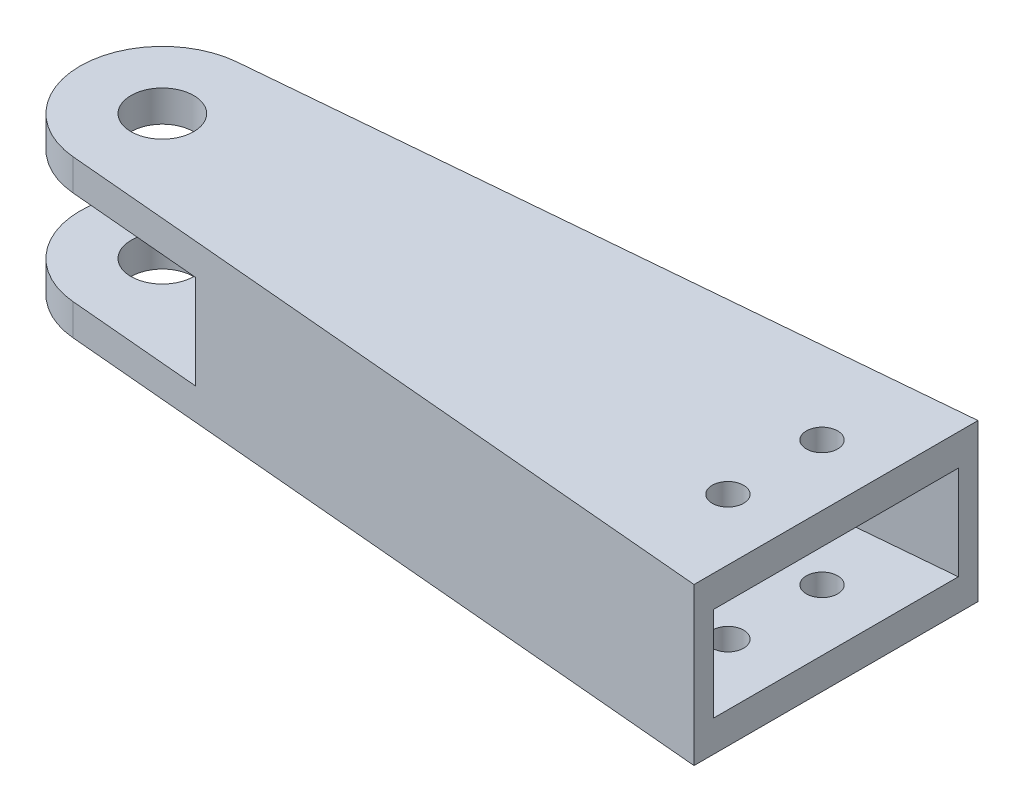
from build123d import *

# Parameters (mm, degrees)
BOSS_EXTRUDE1_DEPTH          = 4
BOSS_EXTRUDE2_DEPTH          = 12
BOSS_EXTRUDE3_DEPTH          = 4
SKETCH4_W                    = 31.19276455
SKETCH4_H                    = 12
CUT_EXTRUDE1_DEPTH           = 20
DRAFT1_ANGLE                 = 5.033187306
F_4_0_4_DIAMETER_HOLE1_D     = 4
F_4_0_4_DIAMETER_HOLE1_DEPTH = 4
F_4_0_4_DIAMETER_HOLE2_D     = 4
F_4_0_4_DIAMETER_HOLE2_DEPTH = 20
F_8_0_8_DIAMETER_HOLE1_D     = 8
F_8_0_8_DIAMETER_HOLE1_DEPTH = 4
F_8_0_8_DIAMETER_HOLE2_D     = 8


with BuildPart() as part:
    # Sketch1 → Boss-Extrude1 (new body)
    with BuildSketch(Plane(origin=(0, 20, 0), x_dir=(1, 0, 0), z_dir=(0, 1, 0))):
        with BuildLine():
            Line((-75, -18.10605947), (-75, 18.10605947))
            Line((-75, 18.10605947), (-161.821193893, 10.459512504))
            ThreePointArc((-161.821193893, 10.459512504), (-171.4, 0), (-161.821193893, -10.459512504))
            Line((-161.821193893, -10.459512504), (-75, -18.10605947))
        make_face()
    extrude(amount=-BOSS_EXTRUDE1_DEPTH)

    # Sketch2 → Boss-Extrude2 (add)
    with BuildSketch(Plane.XZ.offset(-16)):
        Polygon((-75, -18.10605947), (-144.730083357, -11.964766849), (-144.510751478, -9.47440673), (-144.510751478, 9.47440673), (-144.730083357, 11.964766849), (-75, 18.10605947), align=None)
    extrude(amount=BOSS_EXTRUDE2_DEPTH)

    # Sketch3 → Boss-Extrude3 (add)
    with BuildSketch(Plane.XZ.offset(-4)):
        with BuildLine():
            Line((-75, -18.10605947), (-161.821193893, -10.459512504))
            ThreePointArc((-161.821193893, -10.459512504), (-171.4, 0), (-161.821193893, 10.459512504))
            Line((-161.821193893, 10.459512504), (-75, 18.10605947))
            Line((-75, 18.10605947), (-75, -18.10605947))
        make_face()
    extrude(amount=BOSS_EXTRUDE3_DEPTH)

    # Sketch4 → Cut-Extrude1 (cut)
    with BuildSketch(Plane(origin=(-75, 0, 0), x_dir=(0, 0, -1), z_dir=(1, 0, 0))):
        with Locations((0, 10)):
            Rectangle(SKETCH4_W, SKETCH4_H)
    extrude(amount=-CUT_EXTRUDE1_DEPTH, mode=Mode.SUBTRACT)

    # Draft1
    draft1_faces = [part.faces().sort_by_distance(p)[0] for p in [
        (-85, 10, 15.596382275),
        (-85, 10, -15.596382275),
    ]]
    draft(draft1_faces, Plane(origin=(-75, 16, 18.10605947), x_dir=(0, 0, 1), z_dir=(1, 0, 0)), DRAFT1_ANGLE)

    # Ø4.0 (4) Diameter Hole1
    with Locations(Plane(origin=(0, 4, 0), x_dir=(1, 0, 0), z_dir=(0, 1, 0))):
        with Locations((-82.8, 6.017614471), (-82.8, -5.982385529)):
            Hole(F_4_0_4_DIAMETER_HOLE1_D / 2, depth=F_4_0_4_DIAMETER_HOLE1_DEPTH)

    # Ø4.0 (4) Diameter Hole2
    with Locations(Plane(origin=(0, 20, 0), x_dir=(1, 0, 0), z_dir=(0, 1, 0))):
        with Locations((-82.8, 6.017614471), (-82.8, -5.982385529)):
            Hole(F_4_0_4_DIAMETER_HOLE2_D / 2, depth=F_4_0_4_DIAMETER_HOLE2_DEPTH)

    # Ø8.0 (8) Diameter Hole1
    with Locations(Plane(origin=(0, 20, 0), x_dir=(1, 0, 0), z_dir=(0, 1, 0))):
        with Locations((-160.9, 0)):
            Hole(F_8_0_8_DIAMETER_HOLE1_D / 2, depth=F_8_0_8_DIAMETER_HOLE1_DEPTH)

    # Ø8.0 (8) Diameter Hole2 (through all)
    with Locations(Plane(origin=(0, 4, 0), x_dir=(1, 0, 0), z_dir=(0, 1, 0))):
        with Locations((-160.9, 0)):
            Hole(F_8_0_8_DIAMETER_HOLE2_D / 2)


solid = part.part
